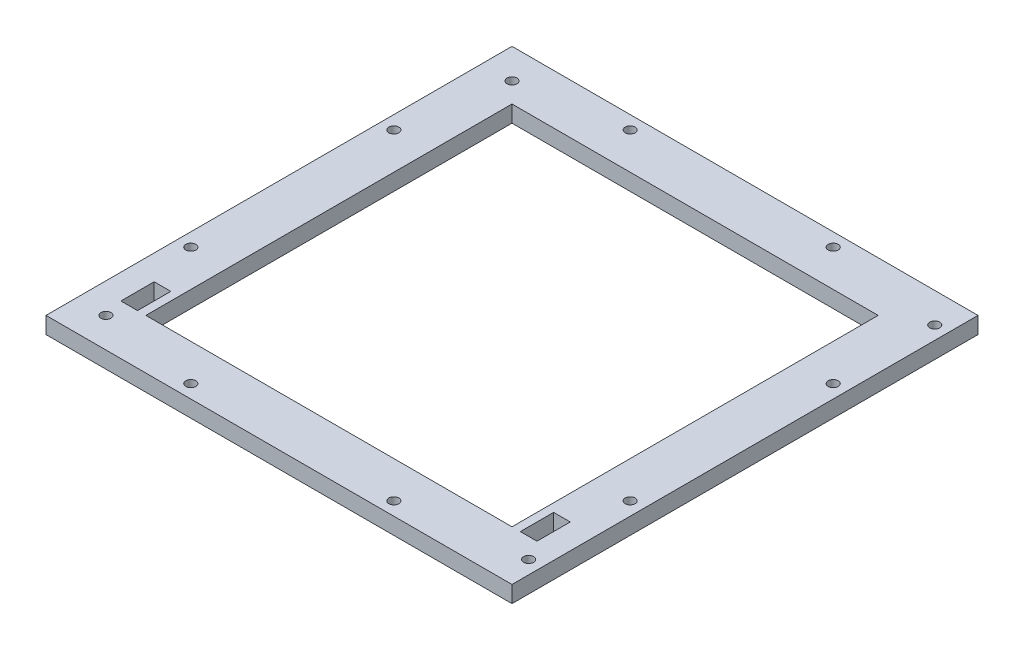
from build123d import *

# Parameters (mm, degrees)
CROQUIS1_W              = 140
CROQUIS1_H              = 140
CROQUIS1_R              = 1.5
CROQUIS1_W_2            = 110
CROQUIS1_H_2            = 110
SALIENTE_EXTRUIR1_DEPTH = 5
CROQUIS2_W              = 5
CROQUIS2_H              = 10
CORTAR_EXTRUIR1_DEPTH   = 5


with BuildPart() as part:
    # Croquis1 → Saliente-Extruir1 (new body)
    with BuildSketch(Plane(origin=(0, 0, 0), x_dir=(1, 0, 0), z_dir=(0, 1, 0))):
        Rectangle(CROQUIS1_W, CROQUIS1_H)
        with Locations(Location((-61, 61, 0), (0, 0, 270))):
            Circle(CROQUIS1_R, mode=Mode.SUBTRACT)
        with Locations(Location((66, 61, 0), (0, 0, 270))):
            Circle(CROQUIS1_R, mode=Mode.SUBTRACT)
        with Locations(Location((66, -61, 0), (0, 0, 270))):
            Circle(CROQUIS1_R, mode=Mode.SUBTRACT)
        with Locations(Location((-61, -61, 0), (0, 0, 270))):
            Circle(CROQUIS1_R, mode=Mode.SUBTRACT)
        with Locations(Location((66, 30.5, 0), (0, 0, 270))):
            Circle(CROQUIS1_R, mode=Mode.SUBTRACT)
        with Locations(Location((66, -30.5, 0), (0, 0, 270))):
            Circle(CROQUIS1_R, mode=Mode.SUBTRACT)
        with Locations(Location((-30.5, -66, 0), (0, 0, 270))):
            Circle(CROQUIS1_R, mode=Mode.SUBTRACT)
        with Locations(Location((30.5, -66, 0), (0, 0, 270))):
            Circle(CROQUIS1_R, mode=Mode.SUBTRACT)
        with Locations(Location((-30.5, 66, 0), (0, 0, 90))):
            Circle(CROQUIS1_R, mode=Mode.SUBTRACT)
        with Locations(Location((30.5, 66, 0), (0, 0, 90))):
            Circle(CROQUIS1_R, mode=Mode.SUBTRACT)
        with Locations(Location((-66, 30.5, 0), (0, 0, 90))):
            Circle(CROQUIS1_R, mode=Mode.SUBTRACT)
        with Locations(Location((-66, -30.5, 0), (0, 0, 90))):
            Circle(CROQUIS1_R, mode=Mode.SUBTRACT)
        Rectangle(CROQUIS1_W_2, CROQUIS1_H_2, mode=Mode.SUBTRACT)
    extrude(amount=SALIENTE_EXTRUIR1_DEPTH)

    # Croquis2 → Cortar-Extruir1 (cut)
    with BuildSketch(Plane(origin=(0, 5, 0), x_dir=(1, 0, 0), z_dir=(0, 1, 0))):
        with Locations((60, -50)):
            Rectangle(CROQUIS2_W, CROQUIS2_H)
        with Locations((-60, -50)):
            Rectangle(CROQUIS2_W, CROQUIS2_H)
    extrude(amount=-CORTAR_EXTRUIR1_DEPTH, mode=Mode.SUBTRACT)


solid = part.part
